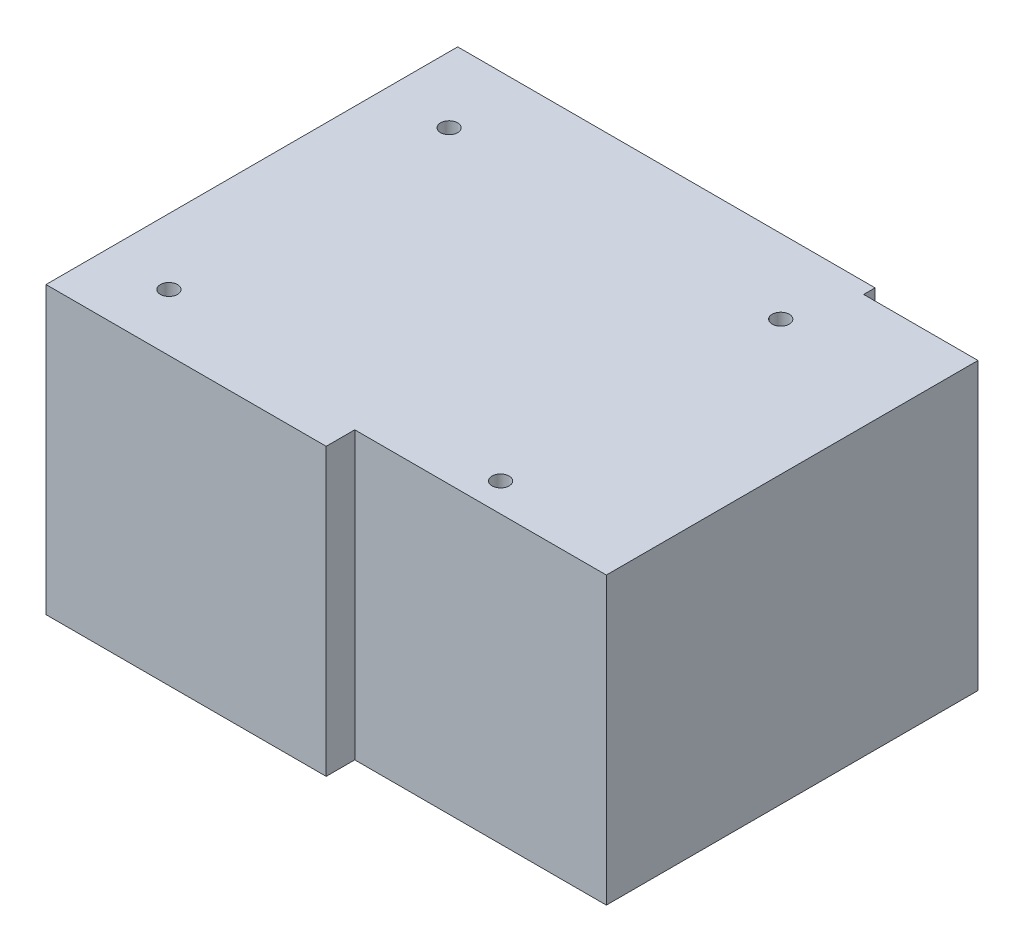
from build123d import *

# Parameters (mm, degrees)
EXTRUDE_1_DEPTH     = 50
SKETCH_2_R          = 1.5
CUT_EXTRUDE_1_DEPTH = 128.800625977


with BuildPart() as part:
    # 草圖1 → 填料-伸長1 (new body)
    with BuildSketch(Plane(origin=(0, 0, 0), x_dir=(1, 0, 0), z_dir=(0, 1, 0))):
        Polygon((0, 0), (49, 0), (49, 5), (93, 5), (93, 70), (73, 70), (73, 72), (52.181672026, 72), (0, 72), align=None)
    extrude(amount=EXTRUDE_1_DEPTH)

    # 草圖2 → 除料-伸長1 (cut, through all)
    with BuildSketch(Plane(origin=(0, 50, 0), x_dir=(1, 0, 0), z_dir=(0, 1, 0))):
        with Locations(Location((11.5, 59, 0), (0, 0, 270))):
            Circle(SKETCH_2_R)
        with Locations(Location((69.5, 59, 0), (0, 0, 270))):
            Circle(SKETCH_2_R)
        with Locations(Location((69.5, 10, 0), (0, 0, 270))):
            Circle(SKETCH_2_R)
        with Locations(Location((11.5, 10, 0), (0, 0, 270))):
            Circle(SKETCH_2_R)
    extrude(amount=-CUT_EXTRUDE_1_DEPTH, mode=Mode.SUBTRACT)


solid = part.part
